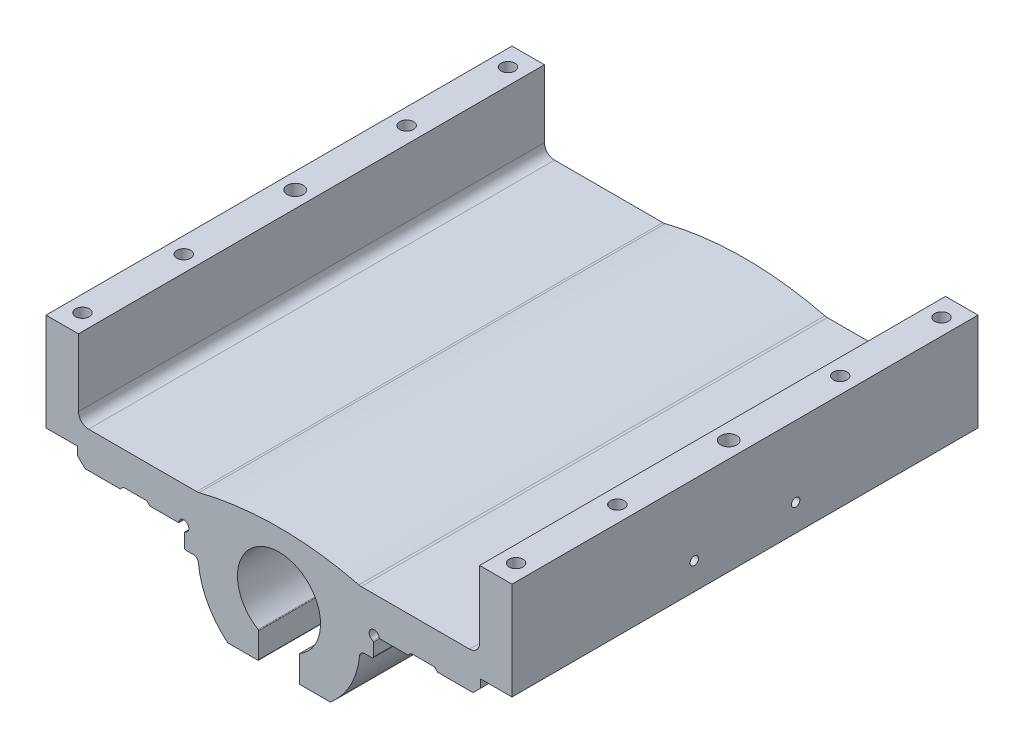
from build123d import *

# Parameters (mm, degrees)
EXTRUDE_1_DEPTH             = 115
SKETCH_2_W                  = 66
SKETCH_2_H                  = 5
SKETCH_2_W_2                = 230
SKETCH_2_H_2                = 11.25
SKETCH_2_W_3                = 15.5
SKETCH_2_H_3                = 4
CUT_EXTRUDE_1_DEPTH         = 292.225234599
HOLE_WIZARD_M8_1_D          = 6.8
HOLE_WIZARD_M8_1_DEPTH      = 25
HOLE_WIZARD_M8_1_TIP        = 2.042926105
MM_1_D                      = 8
MM_1_DEPTH                  = 15
MM_1_TIP                    = 2.403442476
HOLE_WIZARD_M5_1_AT_2_COUNT = 2
HOLE_WIZARD_M5_1_AT_2_PITCH = 50


with BuildPart() as part:
    # 草图1 → 凸台-拉伸1 (new, symmetric)
    with BuildSketch(Plane.XY):
        with BuildLine():
            Line((-40.620192023, 87.200904414), (-94, 87.200904414))
            ThreePointArc((-94, 87.200904414), (-97.535533906, 88.665370508), (-99, 92.200904414))
            Line((-99, 92.200904414), (-99, 134.493797632))
            ThreePointArc((-99, 134.493797632), (-99.038060234, 134.685139349), (-99.146446609, 134.847351023))
            Line((-99.146446609, 134.847351023), (-100.853553391, 136.554457804))
            ThreePointArc((-100.853553391, 136.554457804), (-101.015765065, 136.66284418), (-101.207106781, 136.700904414))
            Line((-101.207106781, 136.700904414), (-112.792893219, 136.700904414))
            ThreePointArc((-112.792893219, 136.700904414), (-112.984234935, 136.66284418), (-113.146446609, 136.554457804))
            Line((-113.146446609, 136.554457804), (-114.853553391, 134.847351023))
            ThreePointArc((-114.853553391, 134.847351023), (-114.961939766, 134.685139349), (-115, 134.493797633))
            Line((-115, 134.493797633), (-115, 76.408011195))
            ThreePointArc((-115, 76.408011195), (-114.961939766, 76.216669479), (-114.853553391, 76.054457804))
            Line((-114.853553391, 76.054457804), (-114.146446609, 75.347351023))
            ThreePointArc((-114.146446609, 75.347351023), (-113.984234935, 75.238964647), (-113.792893219, 75.200904414))
            Line((-113.792893219, 75.200904414), (-103.571067812, 75.200904414))
            ThreePointArc((-103.571067812, 75.200904414), (-101.65765065, 74.820302076), (-100.035533906, 73.73643832))
            Line((-100.035533906, 73.73643832), (-94.75, 68.450904414))
            Line((-94.75, 68.450904414), (-79.3, 68.450904414))
            Line((-79.3, 68.450904414), (-76.8, 70.950904414))
            Line((-76.8, 70.950904414), (-65.2, 70.950904414))
            Line((-65.2, 70.950904414), (-62.7, 68.450904414))
            Line((-62.7, 68.450904414), (-50, 68.450904414))
            ThreePointArc((-50, 68.450904414), (-49.646446609, 68.597351023), (-49.5, 68.950904414))
            Line((-49.5, 68.950904414), (-49.5, 69.450904414))
            ThreePointArc((-49.5, 69.450904414), (-45.469068911, 71.427327951), (-46.375, 67.030289822))
            ThreePointArc((-46.375, 67.030289822), (-46.645284708, 66.852353122), (-46.75, 66.546166904))
            Line((-46.75, 66.546166904), (-46.75, 60.450904414))
            ThreePointArc((-46.75, 60.450904414), (-46.457106781, 59.743797632), (-45.75, 59.450904414))
            Line((-45.75, 59.450904414), (-42.286966077, 59.450904414))
            ThreePointArc((-42.286966077, 59.450904414), (-40.609915094, 58.804954035), (-39.799497484, 57.200904414))
            ThreePointArc((-39.799497484, 57.200904414), (-35.270810958, 42.333739964), (-25.417519793, 30.314828464))
            ThreePointArc((-25.417519793, 30.314828464), (-25.268563981, 30.230246377), (-25.099800796, 30.200904414))
            Line((-25.099800796, 30.200904414), (-10.5, 30.200904414))
            ThreePointArc((-10.5, 30.200904414), (-10.146446609, 30.347351023), (-10, 30.700904414))
            Line((-10, 30.700904414), (-10, 43.014370934))
            ThreePointArc((-10, 43.014370934), (-10.066987298, 43.264370934), (-10.25, 43.447383636))
            ThreePointArc((-10.25, 43.447383636), (0, 81.700904414), (10.25, 43.447383636))
            ThreePointArc((10.25, 43.447383636), (10.066987298, 43.264370934), (10, 43.014370934))
            Line((10, 43.014370934), (10, 30.700904414))
            ThreePointArc((10, 30.700904414), (10.146446609, 30.347351023), (10.5, 30.200904414))
            Line((10.5, 30.200904414), (25.099800796, 30.200904414))
            ThreePointArc((25.099800796, 30.200904414), (25.268563981, 30.230246377), (25.417519793, 30.314828464))
            ThreePointArc((25.417519793, 30.314828464), (35.270810958, 42.333739964), (39.799497484, 57.200904414))
            ThreePointArc((39.799497484, 57.200904414), (40.609915094, 58.804954035), (42.286966077, 59.450904414))
            Line((42.286966077, 59.450904414), (45.75, 59.450904414))
            ThreePointArc((45.75, 59.450904414), (46.457106781, 59.743797632), (46.75, 60.450904414))
            Line((46.75, 60.450904414), (46.75, 66.546166904))
            ThreePointArc((46.75, 66.546166904), (46.645284708, 66.852353122), (46.375, 67.030289822))
            ThreePointArc((46.375, 67.030289822), (45.469068911, 71.427327951), (49.5, 69.450904414))
            Line((49.5, 69.450904414), (49.5, 68.950904414))
            ThreePointArc((49.5, 68.950904414), (49.646446609, 68.597351023), (50, 68.450904414))
            Line((50, 68.450904414), (62.7, 68.450904414))
            Line((62.7, 68.450904414), (65.2, 70.950904414))
            Line((65.2, 70.950904414), (76.8, 70.950904414))
            Line((76.8, 70.950904414), (79.3, 68.450904414))
            Line((79.3, 68.450904414), (94.75, 68.450904414))
            Line((94.75, 68.450904414), (100.035533906, 73.73643832))
            ThreePointArc((100.035533906, 73.73643832), (101.65765065, 74.820302076), (103.571067812, 75.200904414))
            Line((103.571067812, 75.200904414), (113.792893219, 75.200904414))
            ThreePointArc((113.792893219, 75.200904414), (113.984234935, 75.238964647), (114.146446609, 75.347351023))
            Line((114.146446609, 75.347351023), (114.853553391, 76.054457804))
            ThreePointArc((114.853553391, 76.054457804), (114.961939766, 76.216669479), (115, 76.408011195))
            Line((115, 76.408011195), (115, 134.493797632))
            ThreePointArc((115, 134.493797632), (114.961939766, 134.685139348), (114.853553391, 134.847351023))
            Line((114.853553391, 134.847351023), (113.146446609, 136.554457804))
            ThreePointArc((113.146446609, 136.554457804), (112.984234935, 136.66284418), (112.792893219, 136.700904414))
            Line((112.792893219, 136.700904414), (101.207106781, 136.700904414))
            ThreePointArc((101.207106781, 136.700904414), (101.015765065, 136.66284418), (100.853553391, 136.554457804))
            Line((100.853553391, 136.554457804), (99.146446609, 134.847351023))
            ThreePointArc((99.146446609, 134.847351023), (99.038060234, 134.685139349), (99, 134.493797632))
            Line((99, 134.493797632), (99, 92.200904414))
            ThreePointArc((99, 92.200904414), (97.535533906, 88.665370508), (94, 87.200904414))
            Line((94, 87.200904414), (40.620192023, 87.200904414))
            ThreePointArc((40.620192023, 87.200904414), (40.56009167, 87.201265632), (40.5, 87.202349235))
            ThreePointArc((40.5, 87.202349235), (39.949738775, 87.246059064), (39.407648979, 87.350158145))
            ThreePointArc((39.407648979, 87.350158145), (19.852534709, 90.98365881), (0, 92.200904414))
            ThreePointArc((0, 92.200904414), (-19.852534708, 90.98365881), (-39.407648978, 87.350158145))
            ThreePointArc((-39.407648978, 87.350158145), (-39.949738774, 87.246059064), (-40.5, 87.202349235))
            ThreePointArc((-40.5, 87.202349235), (-40.56009167, 87.201265632), (-40.620192023, 87.200904414))
        make_face()
    extrude(amount=EXTRUDE_1_DEPTH, both=True)

    # 草图2 → 切除-拉伸1 (cut, through all)
    with BuildSketch(Plane.XY.offset(115)):
        with Locations((-82, 66.950904414)):
            Rectangle(SKETCH_2_W, SKETCH_2_H)
        with Locations((0, 131.075904414)):
            Rectangle(SKETCH_2_W_2, SKETCH_2_H_2)
        with Locations((82, 66.950904414)):
            Rectangle(SKETCH_2_W, SKETCH_2_H)
        with Locations((-107.25, 75.200904414)):
            Rectangle(SKETCH_2_W_3, SKETCH_2_H_3)
        with Locations((107.25, 75.200904414)):
            Rectangle(SKETCH_2_W_3, SKETCH_2_H_3)
    extrude(amount=-CUT_EXTRUDE_1_DEPTH, mode=Mode.SUBTRACT)

    # M8 螺纹孔1
    with Locations(Plane(origin=(0, 125.450904414, 0), x_dir=(1, 0, 0), z_dir=(0, 1, 0))):
        with Locations((-107, 105), (-107, -55), (-107, 55), (-107, -105), (107, 55), (107, -105), (107, 105), (107, -55)):
            Hole(HOLE_WIZARD_M8_1_D / 2, depth=HOLE_WIZARD_M8_1_DEPTH)
            with Locations((0, 0, -(HOLE_WIZARD_M8_1_DEPTH + HOLE_WIZARD_M8_1_TIP / 2))):  # 118° drill point
                Cone(0, HOLE_WIZARD_M8_1_D / 2, HOLE_WIZARD_M8_1_TIP, mode=Mode.SUBTRACT)

    # 大小mm 暗销孔1
    with Locations(Plane(origin=(0, 125.450904414, 0), x_dir=(1, 0, 0), z_dir=(0, 1, 0))):
        with Locations((-107, 0), (107, 0)):
            Hole(MM_1_D / 2, depth=MM_1_DEPTH)
            with Locations((0, 0, -(MM_1_DEPTH + MM_1_TIP / 2))):  # 118° drill point
                Cone(0, MM_1_D / 2, MM_1_TIP, mode=Mode.SUBTRACT)

    # 草图13 → M5 螺纹孔1 (revolve, cut)
    with BuildSketch(Plane(origin=(115, 90.450904414, 25), x_dir=(0, 0, -1), z_dir=(0, 1, 0))):
        Polygon((0, 0), (0, 13.6618073), (2.1, 12.4), (2.1, 0), align=None)
    hole_wizard_m5_1 = revolve(axis=Axis((121.35, 90.450904414, 25), (-1, 0, 0)), mode=Mode.SUBTRACT)

    # M5 螺纹孔1 at 2: M5 螺纹孔1 ×2
    with Locations(*[(0, 0, -i * HOLE_WIZARD_M5_1_AT_2_PITCH) for i in range(1, HOLE_WIZARD_M5_1_AT_2_COUNT)]):
        add(hole_wizard_m5_1, mode=Mode.SUBTRACT)

    # 镜向1: M5 螺纹孔1 across plane
    add(hole_wizard_m5_1.mirror(Plane(origin=(0, 0, 0), x_dir=(0, 0, 1), z_dir=(1, 0, 0))), mode=Mode.SUBTRACT)

    # 镜向1 copy 1 sketch → 镜向1 copy 1 (revolve, cut)
    with BuildSketch(Plane(origin=(-115, 90.450904414, -25), x_dir=(0, 0, -1), z_dir=(0, 1, 0))):
        Polygon((0, 0), (0, -13.6618073), (2.1, -12.4), (2.1, 0), align=None)
    revolve(axis=Axis((-121.35, 90.450904414, -25), (-1, 0, 0)), mode=Mode.SUBTRACT)


solid = part.part
